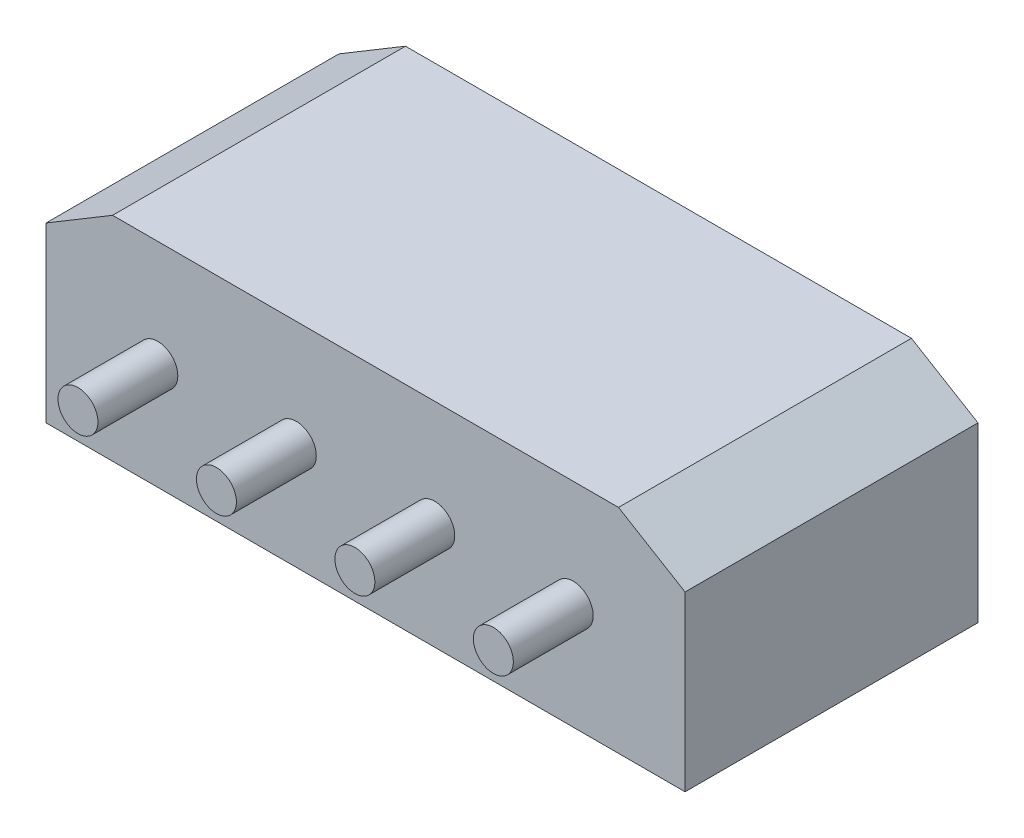
from build123d import *

# Parameters (mm, degrees)
EXTRUDE_1_DEPTH        = 11
CUT_EXTRUDE_1_DEPTH    = 9
SKETCH_3_R             = 0.75
EXTRUDE_2_DEPTH        = 9
SKETCH_4_R             = 1.77312928
CUT_EXTRUDE_2_DEPTH    = 4
PATTERN_LINEAR_1_COUNT = 4
PATTERN_LINEAR_1_PITCH = 5.2


with BuildPart() as part:
    # 草图1 → 凸台-拉伸1 (new body)
    with BuildSketch(Plane.XY):
        Polygon((0, 0), (-24, 0), (-24, 6.5), (-21.5, 8), (-2.5, 8), (0, 6.5), align=None)
    extrude(amount=EXTRUDE_1_DEPTH)

    # 草图2 → 切除-拉伸1 (cut)
    with BuildSketch(Plane(origin=(0, 0, 0), x_dir=(-1, 0, 0), z_dir=(0, 0, -1))):
        Polygon((1, 5.933809621), (1, 1), (23, 1), (23, 5.933809621), (21.223016035, 7), (2.776983965, 7), align=None)
    extrude(amount=-CUT_EXTRUDE_1_DEPTH, mode=Mode.SUBTRACT)

    # 草图3 → 凸台-拉伸2 (add, symmetric)
    with BuildSketch(Plane(origin=(0, 0, 9), x_dir=(-1, 0, 0), z_dir=(0, 0, -1))):
        with Locations(Location((4.2, 4, 0), (0, 0, 180))):
            Circle(SKETCH_3_R)
    extrude_2 = extrude(amount=EXTRUDE_2_DEPTH, both=True)

    # 草图4 → 切除-拉伸2 (cut)
    with BuildSketch(Plane.XY.offset(18)):
        with Locations((-4.2, 4)):
            Circle(SKETCH_4_R)
    cut_extrude_2 = extrude(amount=-CUT_EXTRUDE_2_DEPTH, mode=Mode.SUBTRACT)

    # 阵列(线性)1: 凸台-拉伸2, 切除-拉伸2 ×4
    with Locations(*[(-i * PATTERN_LINEAR_1_PITCH, 0, 0) for i in range(1, PATTERN_LINEAR_1_COUNT)]):
        add(extrude_2)
        add(cut_extrude_2, mode=Mode.SUBTRACT)


solid = part.part
